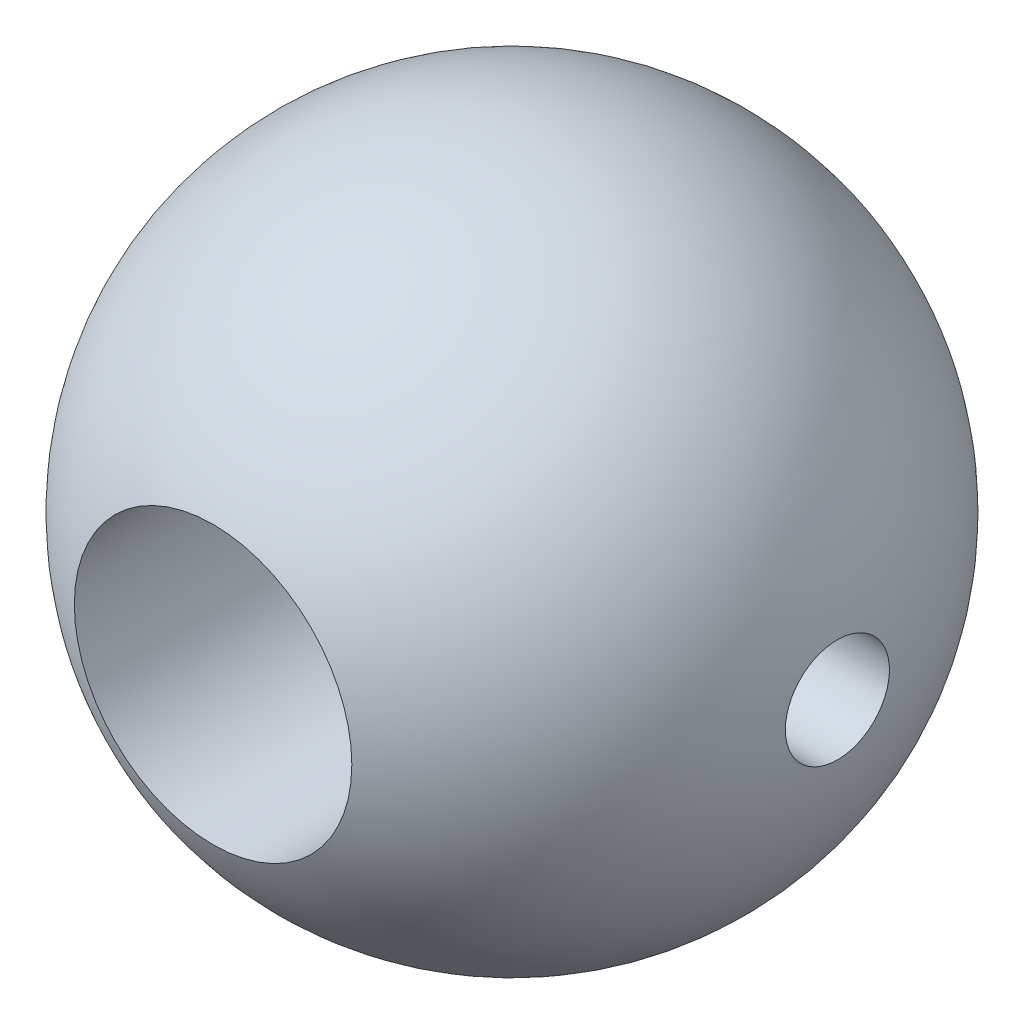
from build123d import *

# Parameters (mm, degrees)
SKETCH2_W = 25.873447289
SKETCH2_H = 1.524


with BuildPart() as part:
    # Sketch1 → Revolve1 (revolve)
    with BuildSketch(Plane(origin=(0, 0, 0), x_dir=(1, 0, 0), z_dir=(0, 1, 0))):
        with BuildLine():
            Line((4.064, 8.754713473), (4.064, -8.754713473))
            ThreePointArc((4.064, -8.754713473), (9.652, 0), (4.064, 8.754713473))
        make_face()
    revolve(axis=Axis((0, 0, 0), (0, 0, 1)))

    # Sketch2 → Cut-Revolve1 (revolve, cut)
    with BuildSketch(Plane(origin=(0, 0, 0), x_dir=(1, 0, 0), z_dir=(0, 1, 0)), mode=Mode.PRIVATE) as cut_revolve1_sk:
        with Locations((1.04874245, 0.762)):
            Rectangle(SKETCH2_W, SKETCH2_H)
    revolve(cut_revolve1_sk.sketch.rotate(Axis((-11.887981195, 0, 0), (1, 0, 0)), 180), axis=Axis((-11.887981195, 0, 0), (1, 0, 0)), mode=Mode.SUBTRACT)


solid = part.part
